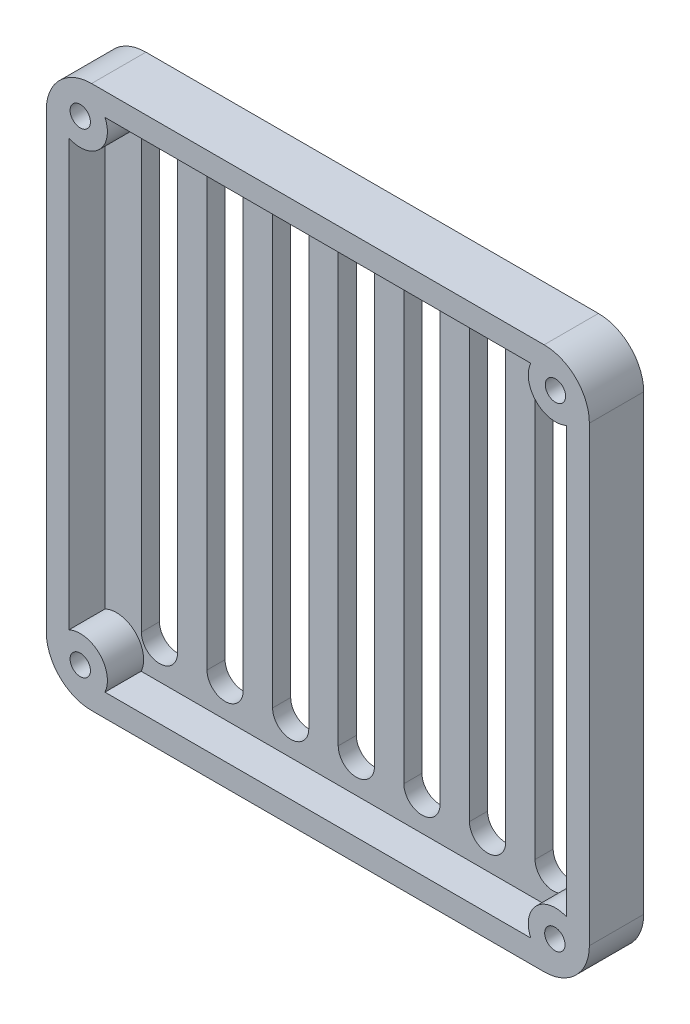
from build123d import *

# Parameters (mm, degrees)
SKETCH1_W           = 120
SKETCH1_H           = 120
SKETCH1_R           = 2.25
BOSS_EXTRUDE1_DEPTH = 4
FILLET1_R           = 10
SKETCH2_R           = 2.25
BOSS_EXTRUDE2_DEPTH = 8
CUT_EXTRUDE1_DEPTH  = 8


with BuildPart() as part:
    # Sketch1 → Boss-Extrude1 (new body)
    with BuildSketch(Plane.XY):
        with Locations((60, 60)):
            Rectangle(SKETCH1_W, SKETCH1_H)
        with Locations((7.5, 112.500076468)):
            Circle(SKETCH1_R, mode=Mode.SUBTRACT)
        with Locations((112.5, 112.500076468)):
            Circle(SKETCH1_R, mode=Mode.SUBTRACT)
        with Locations((7.5, 7.500076468)):
            Circle(SKETCH1_R, mode=Mode.SUBTRACT)
        with Locations((112.373278687, 7.500076468)):
            Circle(SKETCH1_R, mode=Mode.SUBTRACT)
    extrude(amount=BOSS_EXTRUDE1_DEPTH)

    # Fillet1
    fillet1_edges = [part.edges().sort_by_distance(p)[0] for p in [
        (0, 120, 2),
        (120, 120, 2),
        (120, 0, 2),
        (0, 0, 2),
    ]]
    fillet(fillet1_edges, radius=FILLET1_R)

    # Sketch2 → Boss-Extrude2 (add)
    with BuildSketch(Plane.XY.offset(4)):
        with BuildLine():
            Line((0, 110), (0, 10))
            ThreePointArc((0, 10), (2.928932188, 2.928932188), (10, 0))
            Line((10, 0), (110, 0))
            ThreePointArc((110, 0), (117.071067812, 2.928932188), (120, 10))
            Line((120, 10), (120, 110))
            ThreePointArc((120, 110), (117.071067812, 117.071067812), (110, 120))
            Line((110, 120), (10, 120))
            ThreePointArc((10, 120), (2.928932188, 117.071067812), (0, 110))
        make_face()
        with Locations((7.5, 7.500076468)):
            Circle(SKETCH2_R, mode=Mode.SUBTRACT)
        with Locations((112.373278687, 7.500076468)):
            Circle(SKETCH2_R, mode=Mode.SUBTRACT)
        with Locations((112.5, 112.500076468)):
            Circle(SKETCH2_R, mode=Mode.SUBTRACT)
        with Locations((7.5, 112.500076468)):
            Circle(SKETCH2_R, mode=Mode.SUBTRACT)
        with BuildLine():
            Line((5, 107.045720411), (5, 12.954279589))
            ThreePointArc((5, 12.954279589), (11.742610947, 11.742593959), (12.954391106, 5))
            Line((12.954391106, 5), (107.045608894, 5))
            ThreePointArc((107.045608894, 5), (108.257389053, 11.742593959), (115, 12.954279589))
            Line((115, 12.954279589), (115, 107.045720411))
            ThreePointArc((115, 107.045720411), (108.257389053, 108.257406041), (107.045608894, 115))
            Line((107.045608894, 115), (12.954391106, 115))
            ThreePointArc((12.954391106, 115), (11.742610947, 108.257406041), (5, 107.045720411))
        make_face(mode=Mode.SUBTRACT)
    extrude(amount=BOSS_EXTRUDE2_DEPTH)

    # Sketch3 → Cut-Extrude1 (cut)
    with BuildSketch(Plane(origin=(0, 0, 0), x_dir=(-1, 0, 0), z_dir=(0, 0, -1))):
        with BuildLine():
            Line((-100, 107.5), (-100, 12.5))
            ThreePointArc((-100, 12.5), (-104, 8.5), (-108, 12.5))
            Line((-108, 12.5), (-108, 107.5))
            ThreePointArc((-108, 107.5), (-104, 111.5), (-100, 107.5))
        make_face()
        with BuildLine():
            Line((-85.5, 107.5), (-85.5, 12.5))
            ThreePointArc((-85.5, 12.5), (-89.5, 8.5), (-93.5, 12.5))
            Line((-93.5, 12.5), (-93.5, 107.5))
            ThreePointArc((-93.5, 107.5), (-89.5, 111.5), (-85.5, 107.5))
        make_face()
        with BuildLine():
            Line((-71, 107.5), (-71, 12.5))
            ThreePointArc((-71, 12.5), (-75, 8.5), (-79, 12.5))
            Line((-79, 12.5), (-79, 107.5))
            ThreePointArc((-79, 107.5), (-75, 111.5), (-71, 107.5))
        make_face()
        with BuildLine():
            Line((-56.5, 107.5), (-56.5, 12.5))
            ThreePointArc((-56.5, 12.5), (-60.5, 8.5), (-64.5, 12.5))
            Line((-64.5, 12.5), (-64.5, 107.5))
            ThreePointArc((-64.5, 107.5), (-60.5, 111.5), (-56.5, 107.5))
        make_face()
        with BuildLine():
            Line((-42, 107.5), (-42, 12.5))
            ThreePointArc((-42, 12.5), (-46, 8.5), (-50, 12.5))
            Line((-50, 12.5), (-50, 107.5))
            ThreePointArc((-50, 107.5), (-46, 111.5), (-42, 107.5))
        make_face()
        with BuildLine():
            Line((-27.5, 107.5), (-27.5, 12.5))
            ThreePointArc((-27.5, 12.5), (-31.5, 8.5), (-35.5, 12.5))
            Line((-35.5, 12.5), (-35.5, 107.5))
            ThreePointArc((-35.5, 107.5), (-31.5, 111.5), (-27.5, 107.5))
        make_face()
        with BuildLine():
            Line((-13, 107.5), (-13, 12.5))
            ThreePointArc((-13, 12.5), (-17, 8.5), (-21, 12.5))
            Line((-21, 12.5), (-21, 107.5))
            ThreePointArc((-21, 107.5), (-17, 111.5), (-13, 107.5))
        make_face()
    extrude(amount=-CUT_EXTRUDE1_DEPTH, mode=Mode.SUBTRACT)


solid = part.part
